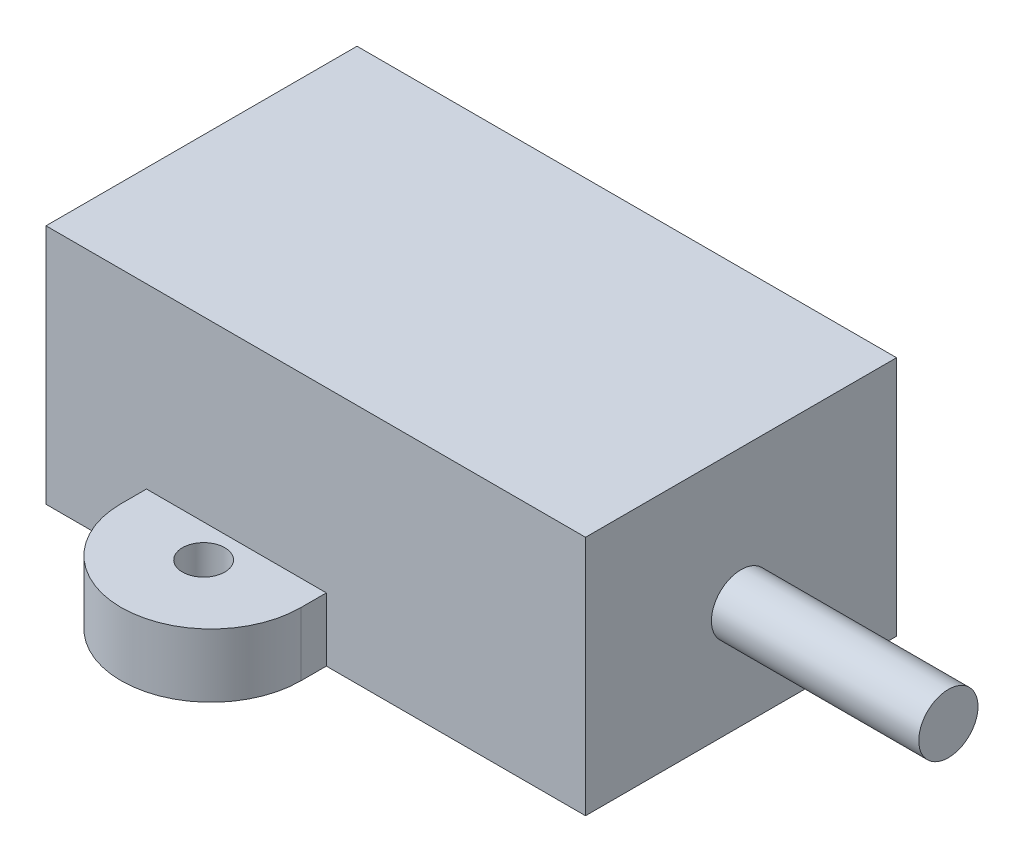
from build123d import *

# Parameters (mm, degrees)
SKETCH_1_W                    = 25.5
SKETCH_1_H                    = 14.7
EXTRUDE_236_DEPTH             = 11.4
SKETCH_2_R                    = 1.4
EXTRUDE_402_DEPTH             = 9.8
SKETCH_3_W                    = 8.5
SKETCH_3_H                    = 5.45
SKETCH_3_R                    = 1
EXTRUDE_667_DEPTH             = 3
FILLET_3_RADIUS               = 4.25
FILLET_3_LENGTH               = 3
FILLET_3_OF_MIRROR_3_2_RADIUS = 4.25
FILLET_3_OF_MIRROR_3_2_LENGTH = 3


with BuildPart() as part:
    # 草图1 → Extrude 236 (new body)
    with BuildSketch(Plane(origin=(0, 0, 0), x_dir=(1, 0, 0), z_dir=(0, 1, 0))):
        Rectangle(SKETCH_1_W, SKETCH_1_H)
    extrude(amount=EXTRUDE_236_DEPTH)

    # 草图2 → Extrude 402 (add)
    with BuildSketch(Plane(origin=(12.75, 0, 0), x_dir=(0, 0, -1), z_dir=(1, 0, 0))):
        with Locations(Location((0, 5, 0), (0, 0, 180))):
            Circle(SKETCH_2_R)
    extrude(amount=EXTRUDE_402_DEPTH)

    # 草图3 → Extrude 667 (add)
    with BuildSketch(Plane.XZ):
        with Locations((-3.75, -10.075)):
            Rectangle(SKETCH_3_W, SKETCH_3_H)
        with Locations(Location((-3.75, -8.9, 0), (0, 0, 270))):
            Circle(SKETCH_3_R, mode=Mode.SUBTRACT)
    extrude_667 = extrude(amount=-EXTRUDE_667_DEPTH)

    # 圆角3: full round fillet: the end face becomes a half cylinder, R = half its width
    fillet_3_face = Plane((-3.75, 1.5, -12.8), x_dir=(0, 1, 0), z_dir=(0, 0, -1))  # on the end face: x along it, z out of the body
    fillet_3_slab = fillet_3_face.offset(-FILLET_3_RADIUS / 2) * Box(FILLET_3_LENGTH, 2 * FILLET_3_RADIUS, FILLET_3_RADIUS, mode=Mode.PRIVATE)  # the body's end, R deep
    fillet_3_round = Plane((-3.75, 1.5, -8.55), x_dir=(0, 0, -1), z_dir=(0, 1, 0)) * Cylinder(FILLET_3_RADIUS, FILLET_3_LENGTH, mode=Mode.PRIVATE)  # its axis R under the face
    add(fillet_3_slab - fillet_3_round, mode=Mode.SUBTRACT)

    # 镜向3: Extrude 667 across plane
    add(extrude_667.mirror(Plane.XY))

    # 圆角3 of Mirror 3 2: full round fillet: the end face becomes a half cylinder, R = half its width
    fillet_3_of_mirror_3_2_face = Plane((-3.75, 1.5, 12.8), x_dir=(0, 1, 0), z_dir=(0, 0, 1))  # on the end face: x along it, z out of the body
    fillet_3_of_mirror_3_2_slab = fillet_3_of_mirror_3_2_face.offset(-FILLET_3_OF_MIRROR_3_2_RADIUS / 2) * Box(FILLET_3_OF_MIRROR_3_2_LENGTH, 2 * FILLET_3_OF_MIRROR_3_2_RADIUS, FILLET_3_OF_MIRROR_3_2_RADIUS, mode=Mode.PRIVATE)  # the body's end, R deep
    fillet_3_of_mirror_3_2_round = Plane((-3.75, 1.5, 8.55), x_dir=(0, 0, 1), z_dir=(0, 1, 0)) * Cylinder(FILLET_3_OF_MIRROR_3_2_RADIUS, FILLET_3_OF_MIRROR_3_2_LENGTH, mode=Mode.PRIVATE)  # its axis R under the face
    add(fillet_3_of_mirror_3_2_slab - fillet_3_of_mirror_3_2_round, mode=Mode.SUBTRACT)


solid = part.part
